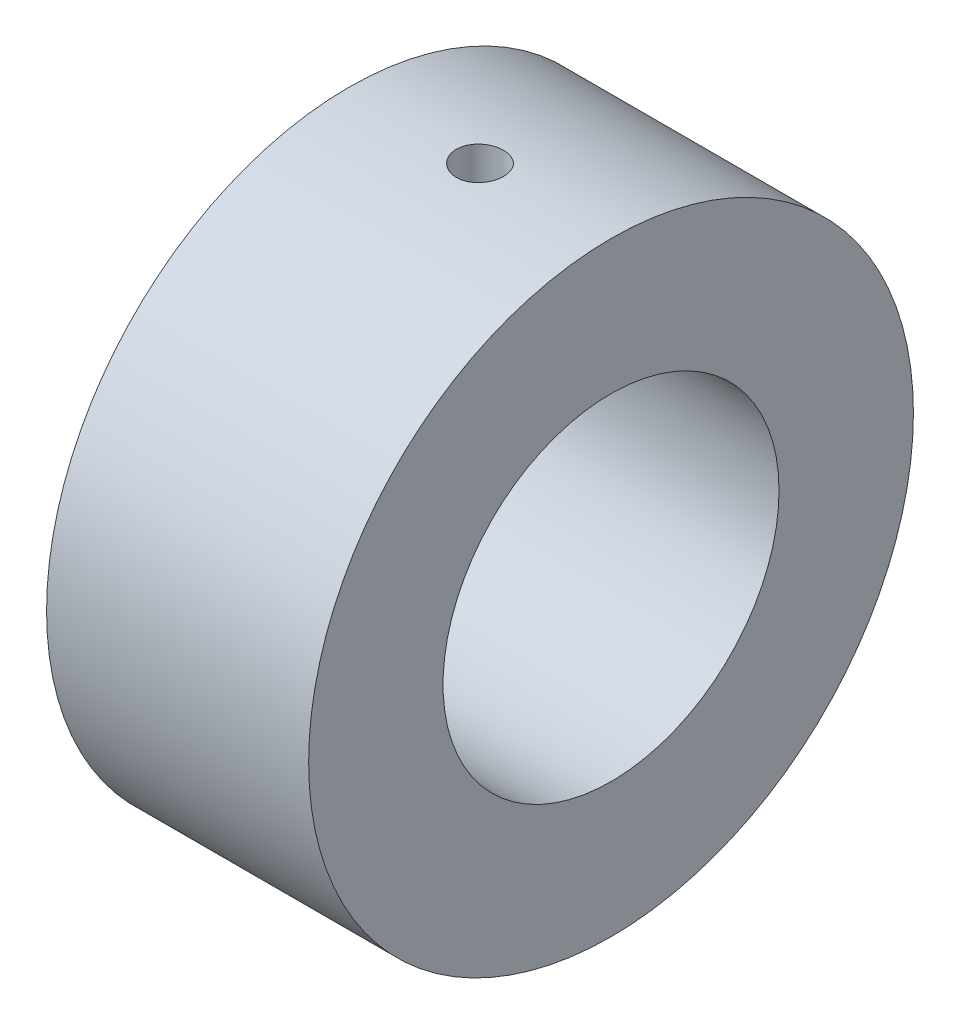
from build123d import *

# Parameters (mm, degrees)
SKETCH1_W          = 39
SKETCH1_H          = 20
SKETCH2_R          = 3.510698781
CUT_EXTRUDE1_DEPTH = 67.560123197


with BuildPart() as part:
    # Sketch1 → Revolve1 (revolve)
    with BuildSketch(Plane.XY, mode=Mode.PRIVATE) as revolve1_sk:
        with Locations((0, 35)):
            Rectangle(SKETCH1_W, SKETCH1_H)
    revolve(revolve1_sk.sketch.rotate(Axis((54.903846154, 0, 0), (-1, 0, 0)), 90), axis=Axis((54.903846154, 0, 0), (-1, 0, 0)))

    # Sketch2 → Cut-Extrude1 (cut, through all)
    with BuildSketch(Plane(origin=(0, 0, 0), x_dir=(1, 0, 0), z_dir=(0, 1, 0))):
        with Locations(Location((0, 0, 0), (0, 0, 90))):
            Circle(SKETCH2_R)
    extrude(amount=CUT_EXTRUDE1_DEPTH, mode=Mode.SUBTRACT)


solid = part.part
